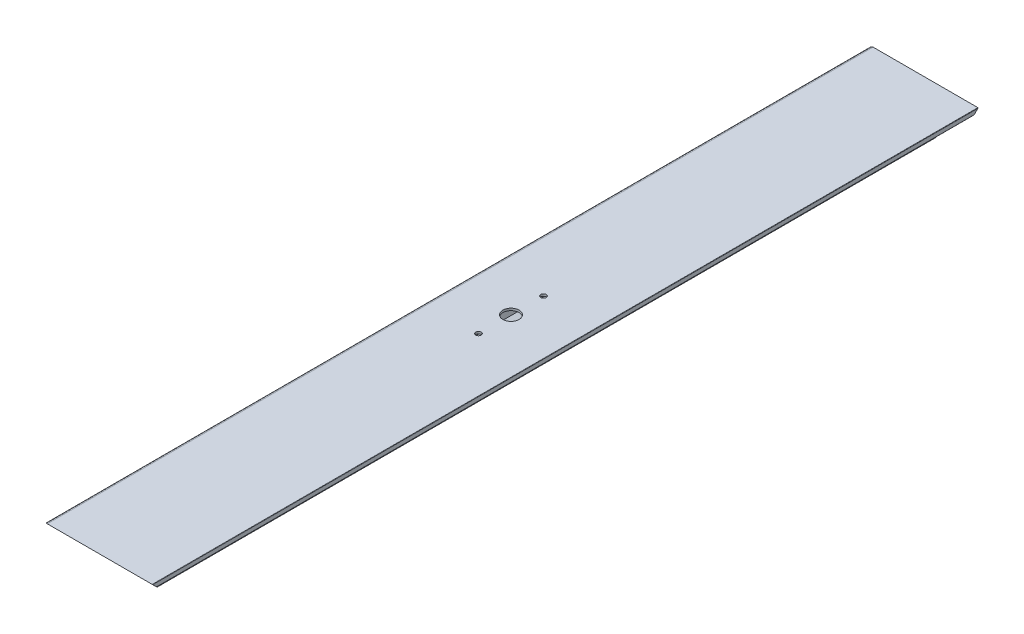
from build123d import *

# Parameters (mm, degrees)
BOSS_EXTRUDE1_DEPTH     = 762
CUT_EXTRUDE1_DEPTH      = 805.176482163
CUT_EXTRUDE2_DEPTH      = 803.239873394
CUT_EXTRUDE2_DEPTH_BACK = 803.239873394
SKETCH4_R               = 2.5
CUT_EXTRUDE3_DEPTH      = 773.997626217
CUT_EXTRUDE3_DEPTH_BACK = 773.997626217
SKETCH5_R               = 7.5
SKETCH5_R_2             = 2.5


with BuildPart() as part:
    # Sketch2 → Boss-Extrude1 (new body)
    with BuildSketch(Plane.XY):
        with BuildLine():
            Line((-28.176229758, 236.761091532), (-124.876229758, 236.761091532))
            ThreePointArc((-124.876229758, 236.761091532), (-126.997550102, 235.882411875), (-127.876229758, 233.761091532))
            Line((-127.876229758, 233.761091532), (-127.876229758, 216.761091532))
            ThreePointArc((-127.876229758, 216.761091532), (-126.997550102, 214.639771188), (-124.876229758, 213.761091532))
            Line((-124.876229758, 213.761091532), (-102.417718129, 213.761091532))
            Line((-102.417718129, 213.761091532), (-93.418737463, 219.298462014))
            Line((-93.418737463, 219.298462014), (-83.376229758, 213.761091532))
            Line((-83.376229758, 213.761091532), (-47.876229758, 213.761091532))
            ThreePointArc((-47.876229758, 213.761091532), (-45.754909415, 214.639771188), (-44.876229758, 216.761091532))
            Line((-44.876229758, 216.761091532), (-44.876229758, 232.461091532))
            ThreePointArc((-44.876229758, 232.461091532), (-44.788361793, 232.673223566), (-44.576229758, 232.761091532))
            Line((-44.576229758, 232.761091532), (-28.176229758, 232.761091532))
            ThreePointArc((-28.176229758, 232.761091532), (-27.964097724, 232.848959498), (-27.876229758, 233.061091532))
            Line((-27.876229758, 233.061091532), (-27.876229758, 236.461091532))
            ThreePointArc((-27.876229758, 236.461091532), (-27.964097724, 236.673223566), (-28.176229758, 236.761091532))
        make_face()
        with BuildLine():
            Line((-49.176229758, 234.761091532), (-92.576229758, 234.761091532))
            ThreePointArc((-92.576229758, 234.761091532), (-92.788361793, 234.673223566), (-92.876229758, 234.461091532))
            Line((-92.876229758, 234.461091532), (-92.876229758, 221.283213521))
            Line((-92.876229758, 221.283213521), (-82.861376535, 215.761091532))
            Line((-82.861376535, 215.761091532), (-50.876229758, 215.761091532))
            ThreePointArc((-50.876229758, 215.761091532), (-49.462016196, 216.34687797), (-48.876229758, 217.761091532))
            Line((-48.876229758, 217.761091532), (-48.876229758, 234.461091532))
            ThreePointArc((-48.876229758, 234.461091532), (-48.964097724, 234.673223566), (-49.176229758, 234.761091532))
        make_face(mode=Mode.SUBTRACT)
        with BuildLine():
            Line((-95.176229758, 234.761091532), (-122.376229758, 234.761091532))
            ThreePointArc((-122.376229758, 234.761091532), (-123.43688993, 234.321751704), (-123.876229758, 233.261091532))
            Line((-123.876229758, 233.261091532), (-123.876229758, 217.261091532))
            ThreePointArc((-123.876229758, 217.261091532), (-123.43688993, 216.20043136), (-122.376229758, 215.761091532))
            Line((-122.376229758, 215.761091532), (-104.891920236, 215.761091532))
            Line((-104.891920236, 215.761091532), (-94.876229758, 221.924077192))
            Line((-94.876229758, 221.924077192), (-94.876229758, 234.461091532))
            ThreePointArc((-94.876229758, 234.461091532), (-94.964097724, 234.673223566), (-95.176229758, 234.761091532))
        make_face(mode=Mode.SUBTRACT)
    extrude(amount=BOSS_EXTRUDE1_DEPTH)

    # Sketch3 → Cut-Extrude1 (cut, through all)
    with BuildSketch(Plane.ZY.offset(127.876229758)):
        Polygon((0, 236.761091532), (23, 213.761091532), (0, 213.761091532), align=None)
        Polygon((762, 236.761091532), (739, 213.761091532), (762, 213.761091532), align=None)
    extrude(amount=-CUT_EXTRUDE1_DEPTH, mode=Mode.SUBTRACT)

    # Sketch4 → Cut-Extrude2 (cut, two sides: drawn at the far end of the back side and taken through both)
    with BuildSketch(Plane(origin=(-44.876229758, 0, 0), x_dir=(0, 0, -1), z_dir=(1, 0, 0)).offset(-CUT_EXTRUDE2_DEPTH_BACK)):
        with Locations(Location((-700.4, 225.961091532, 0), (0, 0, 180))):
            Circle(SKETCH4_R)
        with Locations(Location((-675, 225.961091532, 0), (0, 0, 180))):
            Circle(SKETCH4_R)
        with Locations(Location((-649.6, 225.961091532, 0), (0, 0, 180))):
            Circle(SKETCH4_R)
        with Locations(Location((-624.2, 225.961091532, 0), (0, 0, 180))):
            Circle(SKETCH4_R)
        with Locations(Location((-137.8, 225.961091532, 0), (0, 0, 180))):
            Circle(SKETCH4_R)
        with Locations(Location((-112.4, 225.961091532, 0), (0, 0, 180))):
            Circle(SKETCH4_R)
        with Locations(Location((-87, 225.961091532, 0), (0, 0, 180))):
            Circle(SKETCH4_R)
        with Locations(Location((-61.6, 225.961091532, 0), (0, 0, 180))):
            Circle(SKETCH4_R)
    extrude(amount=CUT_EXTRUDE2_DEPTH + CUT_EXTRUDE2_DEPTH_BACK, mode=Mode.SUBTRACT)

    # Sketch5 → Cut-Extrude3 (cut, two sides: drawn at the far end of the back side and taken through both)
    with BuildSketch(Plane(origin=(0, 236.761091532, 0), x_dir=(1, 0, 0), z_dir=(0, 1, 0)).offset(-CUT_EXTRUDE3_DEPTH_BACK)):
        with Locations(Location((-78.026229758, -381, 0), (0, 0, 229.857845338))):
            Circle(SKETCH5_R)
        with Locations(Location((-78.026229758, -351, 0), (0, 0, 270))):
            Circle(SKETCH5_R_2)
        with Locations(Location((-78.026229758, -411, 0), (0, 0, 270))):
            Circle(SKETCH5_R_2)
    extrude(amount=CUT_EXTRUDE3_DEPTH + CUT_EXTRUDE3_DEPTH_BACK, mode=Mode.SUBTRACT)


solid = part.part
